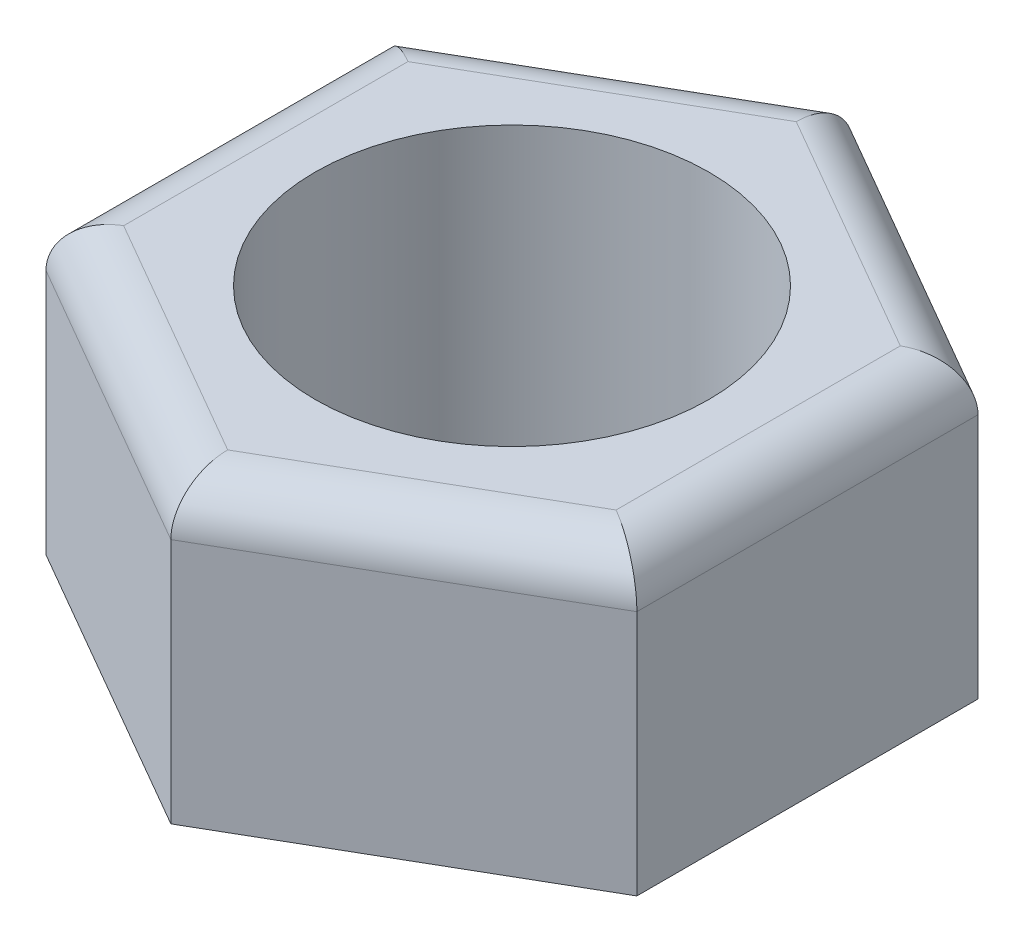
from build123d import *

# Parameters (mm, degrees)
SKETCH1_R           = 1
BOSS_EXTRUDE1_DEPTH = 1.5
FILLET1_R           = 0.25


with BuildPart() as part:
    # Sketch1 → Boss-Extrude1 (new body)
    with BuildSketch(Plane(origin=(0, 0, 0), x_dir=(1, 0, 0), z_dir=(0, 1, 0))):
        Polygon((0, 1.732050808), (-1.5, 0.866025404), (-1.5, -0.866025404), (0, -1.732050808), (1.5, -0.866025404), (1.5, 0.866025404), align=None)
        with Locations(Location((0, 0, 0), (0, 0, 270))):
            Circle(SKETCH1_R, mode=Mode.SUBTRACT)
    extrude(amount=BOSS_EXTRUDE1_DEPTH)

    # Fillet1
    fillet1_edges = [part.edges().sort_by_distance(p)[0] for p in [
        (-1.5, 1.5, 0),
        (-0.75, 1.5, 1.299038106),
        (0.75, 1.5, 1.299038106),
        (1.5, 1.5, 0),
        (0.75, 1.5, -1.299038106),
        (-0.75, 1.5, -1.299038106),
    ]]
    fillet(fillet1_edges, radius=FILLET1_R)


solid = part.part
